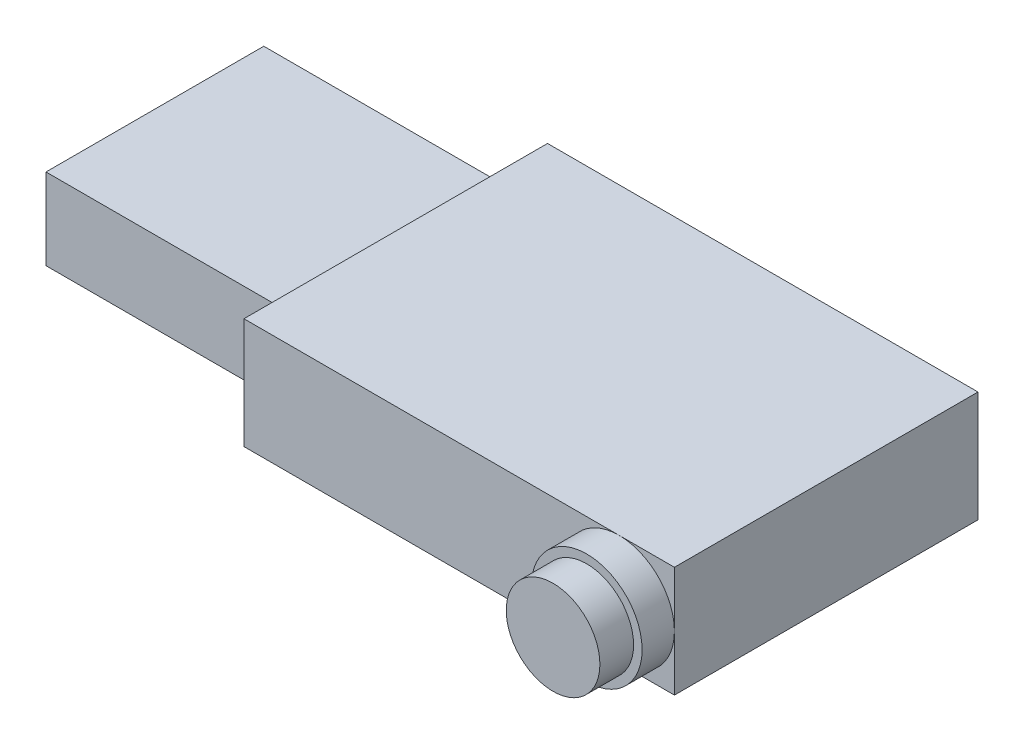
from build123d import *

# Parameters (mm, degrees)
SKETCH1_W           = 23.6982
SKETCH1_H           = 16.7132
BOSS_EXTRUDE1_DEPTH = 6.096
SKETCH2_W           = 11.9888
SKETCH2_H           = 4.4704
BOSS_EXTRUDE2_DEPTH = 13.2588
SKETCH3_W           = 11.3792
SKETCH3_H           = 2.0574
CUT_EXTRUDE1_DEPTH  = 9.017
SKETCH4_R           = 3.048
BOSS_EXTRUDE3_DEPTH = 1.778
SKETCH5_R           = 2.5781
BOSS_EXTRUDE4_DEPTH = 1.8542


with BuildPart() as part:
    # Sketch1 → Boss-Extrude1 (new body)
    with BuildSketch(Plane(origin=(0, 0, 0), x_dir=(1, 0, 0), z_dir=(0, 1, 0))):
        with Locations((11.8491, 8.3566)):
            Rectangle(SKETCH1_W, SKETCH1_H)
    extrude(amount=BOSS_EXTRUDE1_DEPTH)

    # Sketch2 → Boss-Extrude2 (add)
    with BuildSketch(Plane.ZY):
        with Locations((-8.3566, 3.048)):
            Rectangle(SKETCH2_W, SKETCH2_H)
    extrude(amount=BOSS_EXTRUDE2_DEPTH)

    # Sketch3 → Cut-Extrude1 (cut)
    with BuildSketch(Plane.ZY.offset(13.2588)):
        with Locations((-8.3566, 2.1463)):
            Rectangle(SKETCH3_W, SKETCH3_H)
    extrude(amount=-CUT_EXTRUDE1_DEPTH, mode=Mode.SUBTRACT)

    # Sketch4 → Boss-Extrude3 (add)
    with BuildSketch(Plane.XY):
        with Locations((20.6502, 3.048)):
            Circle(SKETCH4_R)
    extrude(amount=BOSS_EXTRUDE3_DEPTH)

    # Sketch5 → Boss-Extrude4 (add)
    with BuildSketch(Plane.XY.offset(1.778)):
        with Locations((20.6502, 3.048)):
            Circle(SKETCH5_R)
    extrude(amount=BOSS_EXTRUDE4_DEPTH)


solid = part.part
